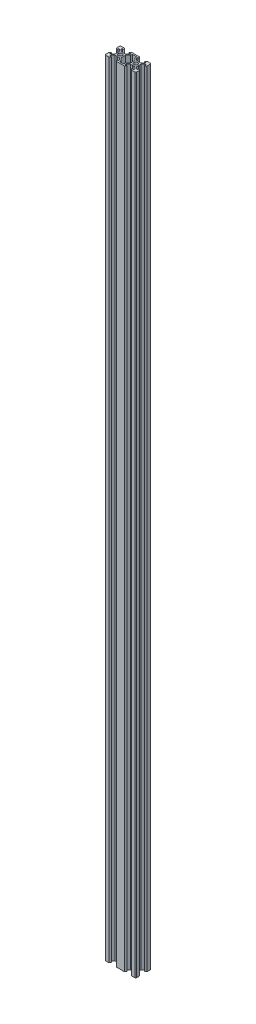
from build123d import *

# Parameters (mm, degrees)
SKETCH13_R                                  = 2.5
RETANGULAR_PF20_12_PERFIL_2040_V_SLOT_DEPTH = 1015


with BuildPart() as part:
    # Sketch13 → Retangular PF20-12 - PERFIL 2040 V-SLOT(1) (new body)
    with BuildSketch(Plane(origin=(0, 0, 0), x_dir=(-1, 0, 0), z_dir=(0, 1, 0))):
        with BuildLine():
            Line((-14.8, 10), (-13, 8.2))
            Line((-13, 8.2), (-15.5, 8.2))
            Line((-15.5, 8.2), (-15.5, 6.560660172))
            Line((-15.5, 6.560660172), (-12.939339828, 4))
            Line((-12.939339828, 4), (-10.3, 4))
            Line((-10.3, 4), (-10, 3.7))
            Line((-10, 3.7), (-9.7, 4))
            Line((-9.7, 4), (-7.060660172, 4))
            Line((-7.060660172, 4), (-4.5, 6.560660172))
            Line((-4.5, 6.560660172), (-4.5, 8.2))
            Line((-4.5, 8.2), (-7, 8.2))
            Line((-7, 8.2), (-5.2, 10))
            Line((-5.2, 10), (5.2, 10))
            Line((5.2, 10), (7, 8.2))
            Line((7, 8.2), (4.5, 8.2))
            Line((4.5, 8.2), (4.5, 6.560660172))
            Line((4.5, 6.560660172), (7.060660172, 4))
            Line((7.060660172, 4), (9.7, 4))
            Line((9.7, 4), (10, 3.7))
            Line((10, 3.7), (10.3, 4))
            Line((10.3, 4), (12.939339828, 4))
            Line((12.939339828, 4), (15.5, 6.560660172))
            Line((15.5, 6.560660172), (15.5, 8.2))
            Line((15.5, 8.2), (13, 8.2))
            Line((13, 8.2), (14.8, 10))
            Line((14.8, 10), (19, 10))
            ThreePointArc((19, 10), (19.707106781, 9.707106781), (20, 9))
            Line((20, 9), (20, 4.8))
            Line((20, 4.8), (18.2, 3))
            Line((18.2, 3), (18.2, 5.5))
            Line((18.2, 5.5), (16.560660172, 5.5))
            Line((16.560660172, 5.5), (14, 2.939339828))
            Line((14, 2.939339828), (14, 0.3))
            Line((14, 0.3), (13.7, 0))
            Line((13.7, 0), (14, -0.3))
            Line((14, -0.3), (14, -2.939339828))
            Line((14, -2.939339828), (16.560660172, -5.5))
            Line((16.560660172, -5.5), (18.2, -5.5))
            Line((18.2, -5.5), (18.2, -3))
            Line((18.2, -3), (20, -4.8))
            Line((20, -4.8), (20, -9))
            ThreePointArc((20, -9), (19.707106781, -9.707106781), (19, -10))
            Line((19, -10), (14.8, -10))
            Line((14.8, -10), (13, -8.2))
            Line((13, -8.2), (15.5, -8.2))
            Line((15.5, -8.2), (15.5, -6.560660172))
            Line((15.5, -6.560660172), (12.939339828, -4))
            Line((12.939339828, -4), (10.3, -4))
            Line((10.3, -4), (10, -3.7))
            Line((10, -3.7), (9.7, -4))
            Line((9.7, -4), (7.060660172, -4))
            Line((7.060660172, -4), (4.5, -6.560660172))
            Line((4.5, -6.560660172), (4.5, -8.2))
            Line((4.5, -8.2), (7, -8.2))
            Line((7, -8.2), (5.2, -10))
            Line((5.2, -10), (-5.2, -10))
            Line((-5.2, -10), (-7, -8.2))
            Line((-7, -8.2), (-4.5, -8.2))
            Line((-4.5, -8.2), (-4.5, -6.560660172))
            Line((-4.5, -6.560660172), (-7.060660172, -4))
            Line((-7.060660172, -4), (-9.7, -4))
            Line((-9.7, -4), (-10, -3.7))
            Line((-10, -3.7), (-10.3, -4))
            Line((-10.3, -4), (-12.939339828, -4))
            Line((-12.939339828, -4), (-15.5, -6.560660172))
            Line((-15.5, -6.560660172), (-15.5, -8.2))
            Line((-15.5, -8.2), (-13, -8.2))
            Line((-13, -8.2), (-14.8, -10))
            Line((-14.8, -10), (-19, -10))
            ThreePointArc((-19, -10), (-19.707106781, -9.707106781), (-20, -9))
            Line((-20, -9), (-20, -4.8))
            Line((-20, -4.8), (-18.2, -3))
            Line((-18.2, -3), (-18.2, -5.5))
            Line((-18.2, -5.5), (-16.560660172, -5.5))
            Line((-16.560660172, -5.5), (-14, -2.939339828))
            Line((-14, -2.939339828), (-14, -0.3))
            Line((-14, -0.3), (-13.7, 0))
            Line((-13.7, 0), (-14, 0.3))
            Line((-14, 0.3), (-14, 2.939339828))
            Line((-14, 2.939339828), (-16.560660172, 5.5))
            Line((-16.560660172, 5.5), (-18.2, 5.5))
            Line((-18.2, 5.5), (-18.2, 3))
            Line((-18.2, 3), (-20, 4.8))
            Line((-20, 4.8), (-20, 9))
            ThreePointArc((-20, 9), (-19.707106781, 9.707106781), (-19, 10))
            Line((-19, 10), (-14.8, 10))
        make_face()
        with Locations((-10, 0)):
            Circle(SKETCH13_R, mode=Mode.SUBTRACT)
        with Locations((10, 0)):
            Circle(SKETCH13_R, mode=Mode.SUBTRACT)
        Polygon((-2.7, 8.2), (-2.7, 6.239339828), (-6, 2.939339828), (-6, -2.939339828), (-2.7, -6.239339828), (-2.7, -8.2), (2.7, -8.2), (2.7, -6.239339828), (6, -2.939339828), (6, 2.939339828), (2.7, 6.239339828), (2.7, 8.2), align=None, mode=Mode.SUBTRACT)
    extrude(amount=RETANGULAR_PF20_12_PERFIL_2040_V_SLOT_DEPTH)


solid = part.part
